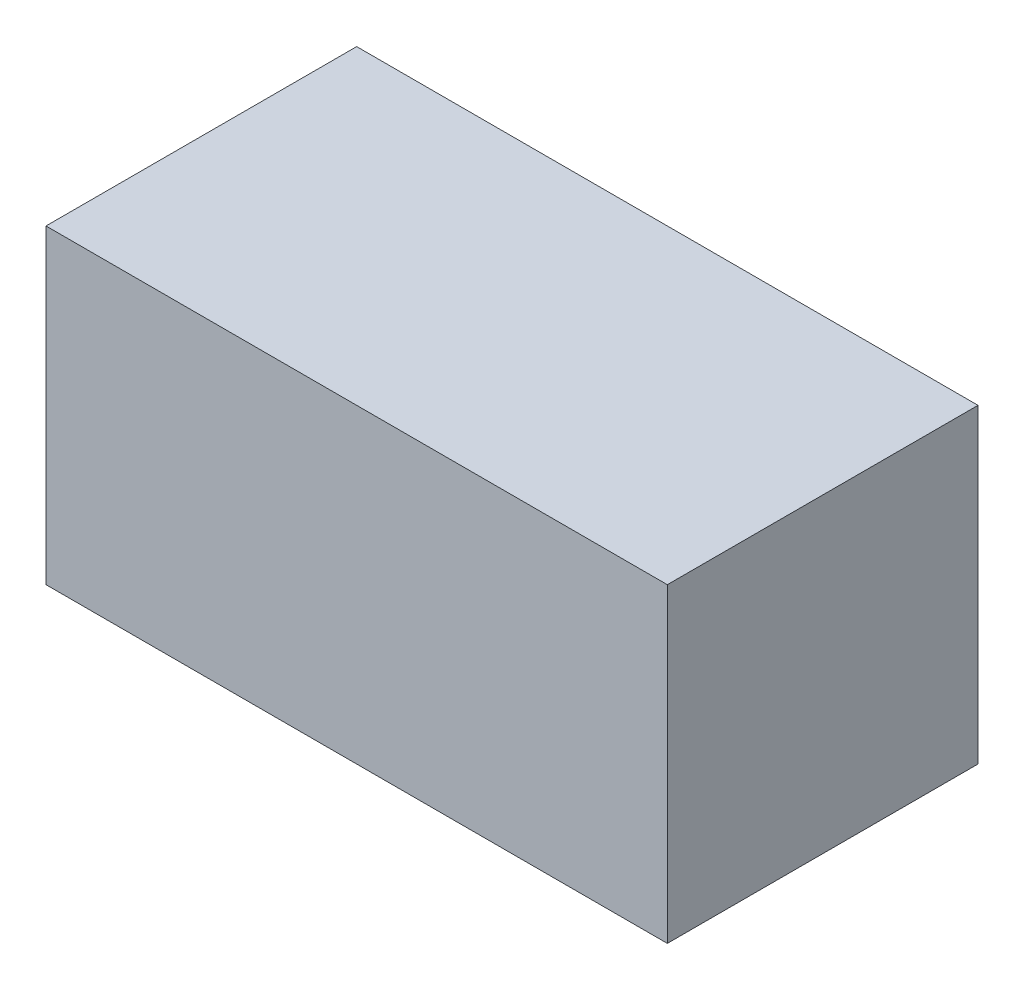
from build123d import *

# Parameters (mm, degrees)
SKETCH1_W           = 40
SKETCH1_H           = 20
BOSS_EXTRUDE1_DEPTH = 10
SKETCH2_R           = 4
CUT_EXTRUDE1_DEPTH  = 5


with BuildPart() as part:
    # Sketch1 → Boss-Extrude1 (new, symmetric)
    with BuildSketch(Plane.XY):
        with Locations((20, 10)):
            Rectangle(SKETCH1_W, SKETCH1_H)
    extrude(amount=BOSS_EXTRUDE1_DEPTH, both=True)

    # Sketch2 → Cut-Extrude1 (cut)
    with BuildSketch(Plane.XY):
        with Locations((20, 10)):
            Circle(SKETCH2_R)
    extrude(amount=-CUT_EXTRUDE1_DEPTH, mode=Mode.SUBTRACT)


solid = part.part
